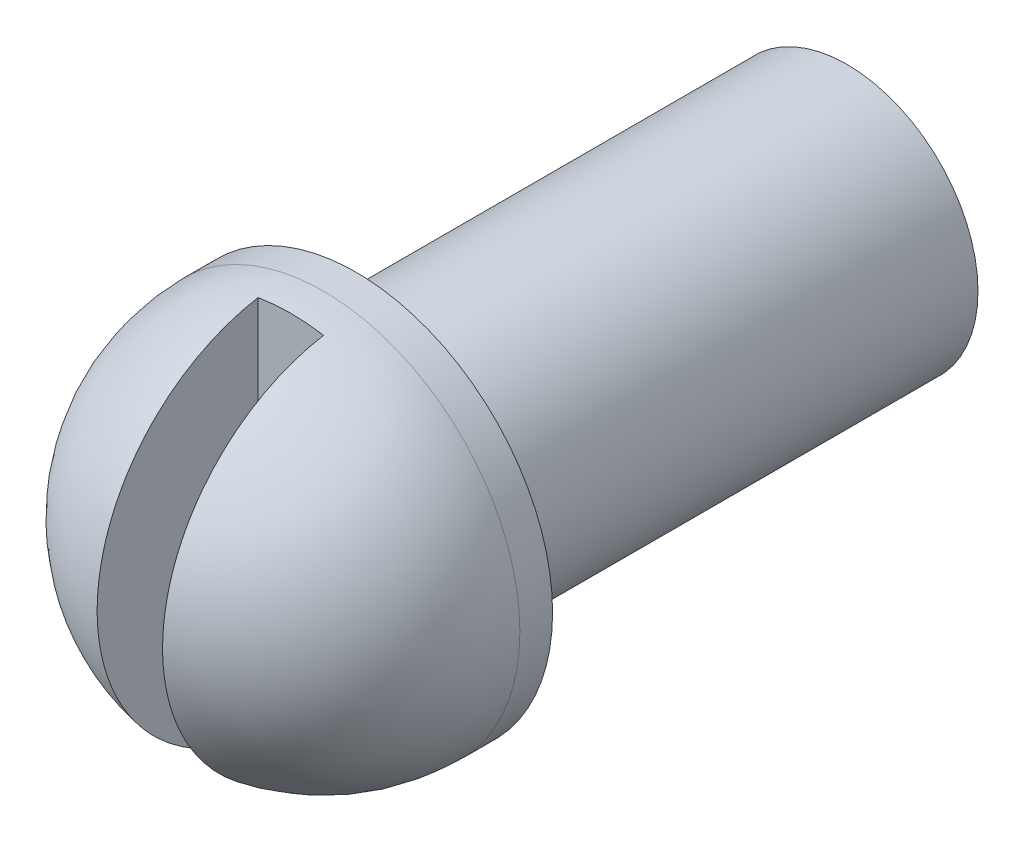
from build123d import *

# Parameters (mm, degrees)
SKETCH1_R           = 4
BOSS_EXTRUDE1_DEPTH = 15
SKETCH2_R           = 6
BOSS_EXTRUDE2_DEPTH = 1
DOME1_FACE_RADIUS   = 6
DOME1_HEIGHT        = 6
SKETCH3_W           = 2
SKETCH3_H           = 12.932996947
CUT_EXTRUDE2_DEPTH  = 5


with BuildPart() as part:
    # Sketch1 → Boss-Extrude1 (new body)
    with BuildSketch(Plane.XY):
        Circle(SKETCH1_R)
    extrude(amount=BOSS_EXTRUDE1_DEPTH)

    # Sketch2 → Boss-Extrude2 (add)
    with BuildSketch(Plane.XY.offset(15)):
        Circle(SKETCH2_R)
    extrude(amount=BOSS_EXTRUDE2_DEPTH)

    # Dome1: a dome of height H over a round flat face of radius A is a cap of a sphere of radius (A * A + H * H) / (2 * H)
    dome1_r = (DOME1_FACE_RADIUS * DOME1_FACE_RADIUS + DOME1_HEIGHT * DOME1_HEIGHT) / (2 * DOME1_HEIGHT)
    dome1_base = Plane((0, 0, 16), z_dir=(0, 0, 1))
    with Locations(dome1_base.offset(DOME1_HEIGHT - dome1_r)):
        dome1_ball = Sphere(dome1_r, mode=Mode.PRIVATE)
    add(split(dome1_ball, bisect_by=dome1_base, keep=Keep.TOP, mode=Mode.PRIVATE))

    # Sketch3 → Cut-Extrude2 (cut)
    with BuildSketch(Plane.XY.offset(22)):
        with Locations((0, -0.226721745)):
            Rectangle(SKETCH3_W, SKETCH3_H)
    extrude(amount=-CUT_EXTRUDE2_DEPTH, mode=Mode.SUBTRACT)


solid = part.part
